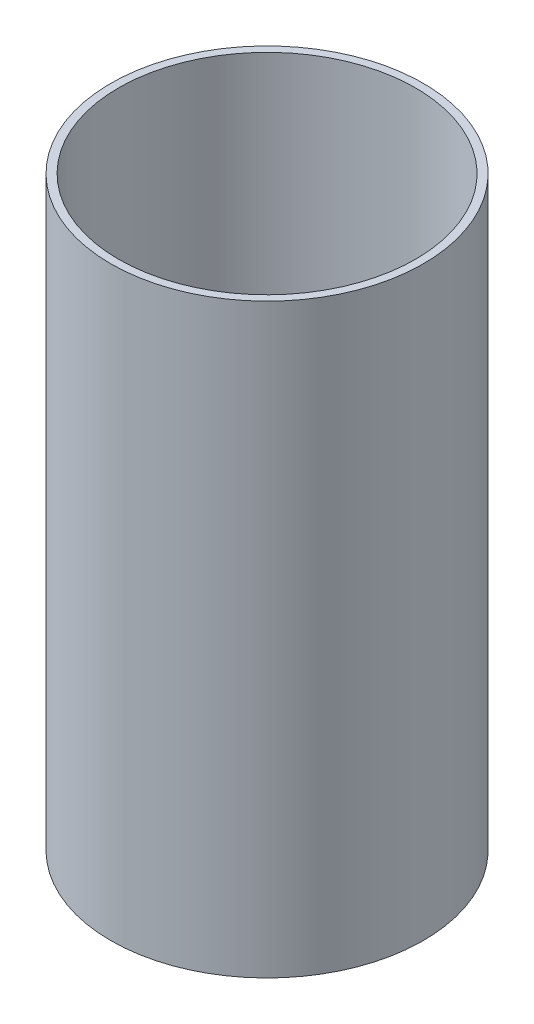
from build123d import *

# Parameters (mm, degrees)
SKETCH1_R           = 40
SKETCH1_R_2         = 38
BOSS_EXTRUDE1_DEPTH = 150


with BuildPart() as part:
    # Sketch1 → Boss-Extrude1 (new body)
    with BuildSketch(Plane(origin=(0, 0, 0), x_dir=(1, 0, 0), z_dir=(0, 1, 0))):
        with Locations(Location((0, 0, 0), (0, 0, 270))):
            Circle(SKETCH1_R)
        with Locations(Location((0, 0, 0), (0, 0, 270))):
            Circle(SKETCH1_R_2, mode=Mode.SUBTRACT)
    extrude(amount=BOSS_EXTRUDE1_DEPTH)


solid = part.part
